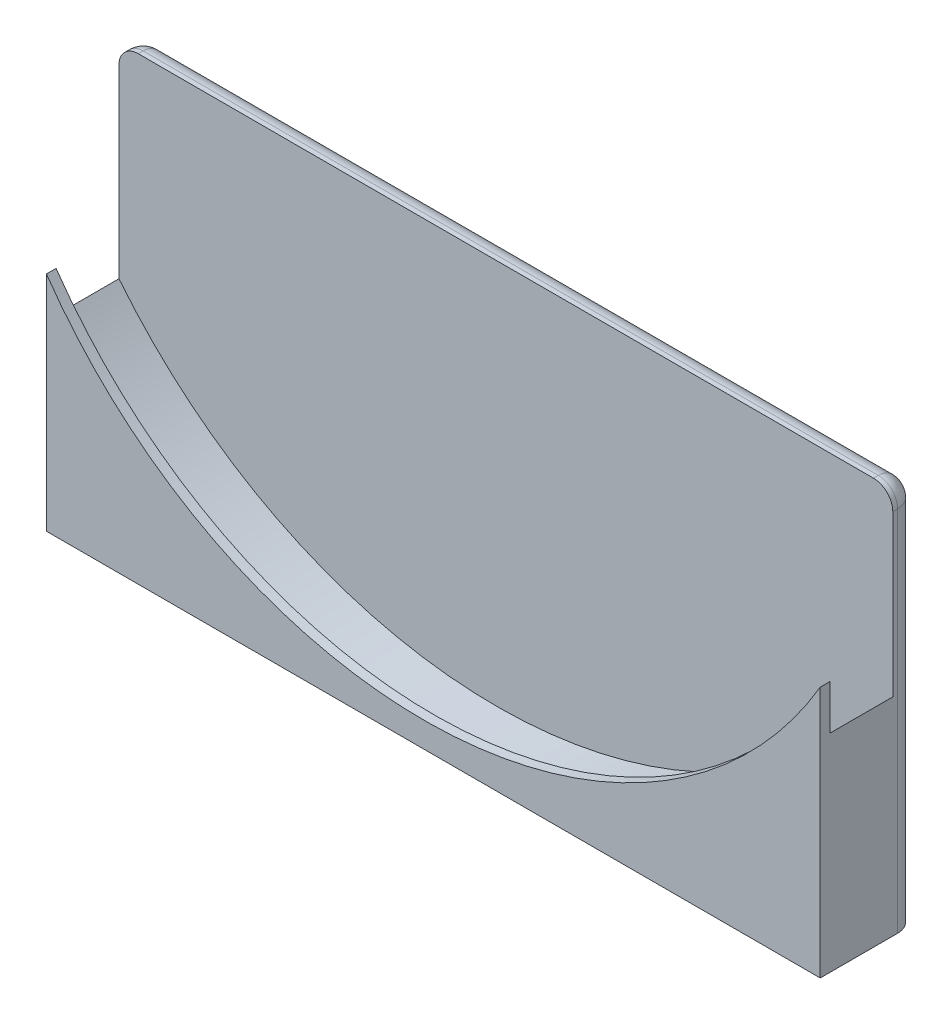
from build123d import *

# Parameters (mm, degrees)
SKETCH1_W           = 80
SKETCH1_H           = 10
BOSS_EXTRUDE1_DEPTH = 40
SKETCH2_R           = 47.5
CUT_EXTRUDE1_DEPTH  = 7.5
SKETCH3_R           = 50
CUT_EXTRUDE2_DEPTH  = 6.5
FILLET1_R           = 2
FILLET2_R           = 2


with BuildPart() as part:
    # Sketch1 → Boss-Extrude1 (new body)
    with BuildSketch(Plane(origin=(0, 0, 0), x_dir=(1, 0, 0), z_dir=(0, 1, 0))):
        with Locations((-2.66565113, -7.064446738)):
            Rectangle(SKETCH1_W, SKETCH1_H)
    extrude(amount=BOSS_EXTRUDE1_DEPTH)

    # Sketch2 → Cut-Extrude1 (cut)
    with BuildSketch(Plane.XY.offset(12.064446738)):
        with Locations((-3.625057346, 50.093821186)):
            Circle(SKETCH2_R)
    extrude(amount=-CUT_EXTRUDE1_DEPTH, mode=Mode.SUBTRACT)

    # Sketch3 → Cut-Extrude2 (cut)
    with BuildSketch(Plane.XY.offset(11.064446738)):
        with Locations((-3.625057346, 50.093821186)):
            Circle(SKETCH3_R)
    extrude(amount=-CUT_EXTRUDE2_DEPTH, mode=Mode.SUBTRACT)

    # Fillet1
    fillet1_edges = [part.edges().sort_by_distance(p)[0] for p in [
        (-42.66565113, 40, 3.314446738),
        (37.33434887, 40, 3.314446738),
    ]]
    fillet(fillet1_edges, radius=FILLET1_R)

    # Fillet2
    fillet2_edges = [part.edges().sort_by_distance(p)[0] for p in [
        (-2.66565113, 40, 2.064446738),
        (-42.66565113, 19, 2.064446738),
        (37.33434887, 19, 2.064446738),
        (-42.079864693, 39.414213562, 2.064446738),
        (36.748562432, 39.414213562, 2.064446738),
    ]]
    fillet(fillet2_edges, radius=FILLET2_R)


solid = part.part
